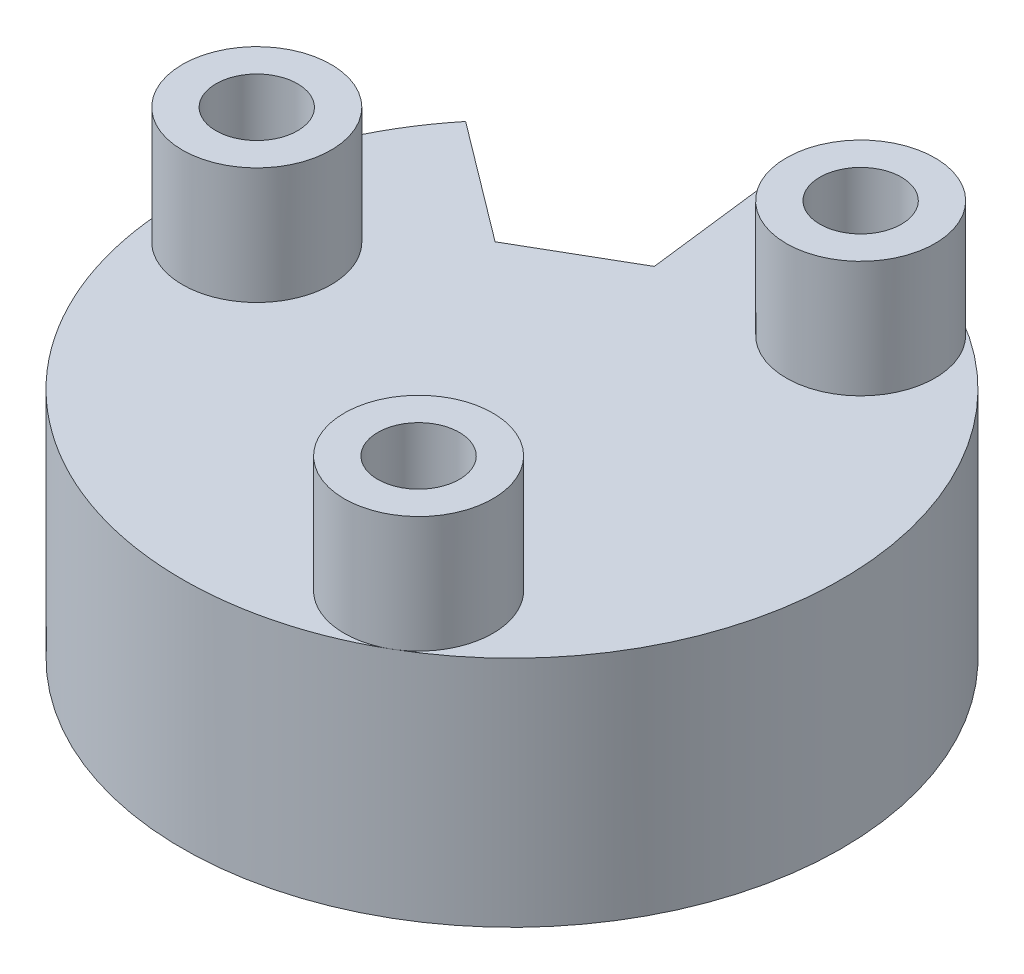
from build123d import *

# Parameters (mm, degrees)
BOSS_EXTRUDE1_DEPTH  = 20
SKETCH4_R            = 6.375
BOSS_EXTRUDE2_DEPTH  = 10
CUT_EXTRUDE1_DEPTH   = 12
D_GAGEMENT_M1_61_D   = 7
D_GAGEMENT_M21_D     = 3.3
D_GAGEMENT_M21_DEPTH = 11.597810211


with BuildPart() as part:
    # Sketch3 → Boss-Extrude1 (new body)
    with BuildSketch(Plane(origin=(0, 0, 0), x_dir=(1, 0, 0), z_dir=(0, 1, 0))):
        with BuildLine():
            Line((-21.884054787, 17.904294766), (-11.679032124, 10.228677023))
            Line((-11.679032124, 10.228677023), (-3.018778087, 15.228677023))
            Line((-3.018778087, 15.228677023), (-4.563546711, 27.904294766))
            ThreePointArc((-4.563546711, 27.904294766), (14.1375, -24.486868292), (-21.884054787, 17.904294766))
        make_face()
    extrude(amount=BOSS_EXTRUDE1_DEPTH)

    # Sketch4 → Boss-Extrude2 (add)
    with BuildSketch(Plane(origin=(0, 20, 0), x_dir=(1, 0, 0), z_dir=(0, 1, 0))):
        with Locations(Location((-21.9, 0, 0), (0, 0, 179.999635348))):
            Circle(SKETCH4_R)
        with Locations(Location((10.95, 18.965956343, 0), (0, 0, 59.999635366))):
            Circle(SKETCH4_R)
        with Locations(Location((10.95, -18.965956343, 0), (0, 0, 299.999635366))):
            Circle(SKETCH4_R)
    extrude(amount=BOSS_EXTRUDE2_DEPTH)

    # Sketch5 → Cut-Extrude1 (cut)
    with BuildSketch(Plane.XZ):
        with BuildLine():
            Line((0.904078238, -4.101541483), (-4.004078238, -1.26781602))
            ThreePointArc((-4.004078238, -1.26781602), (2.1, 3.637306696), (0.904078238, -4.101541483))
        make_face()
    extrude(amount=-CUT_EXTRUDE1_DEPTH, mode=Mode.SUBTRACT)

    # Dégagement M1.61 (through all)
    with Locations(Plane(origin=(0, 30, 0), x_dir=(1, 0, 0), z_dir=(0, 1, 0))):
        with Locations((10.95, 18.965956343), (10.95, -18.965956343), (-21.9, 0)):
            Hole(D_GAGEMENT_M1_61_D / 2)

    # Dégagement M21
    with Locations(Plane(origin=(-7.348905106, 0, -12.728677023), x_dir=(-0.8660254037844386, 0, 0.5000000000000003), z_dir=(-0.5000000000000003, 0, -0.8660254037844386))):
        with Locations((0, 5)):
            Hole(D_GAGEMENT_M21_D / 2, depth=D_GAGEMENT_M21_DEPTH)


solid = part.part
